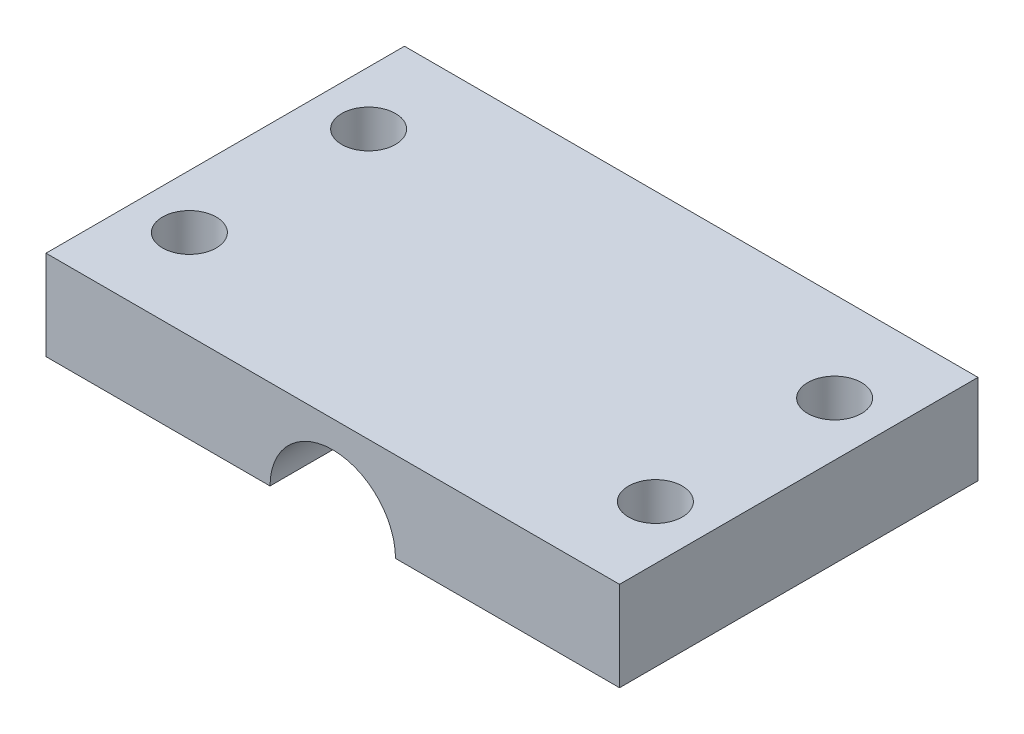
from build123d import *

# Parameters (mm, degrees)
BOSS_EXTRUDE1_DEPTH = 20
CUT_EXTRUDE1_REACH  = 36.478
SKETCH3_R           = 1.5


with BuildPart() as part:
    # Sketch1 → Boss-Extrude1 (new body)
    with BuildSketch(Plane.XY):
        with BuildLine():
            Line((8.135150199, -2.180546666), (-4.364849801, -2.180546666))
            Line((-4.364849801, -2.180546666), (-4.364849801, 2.819453334))
            Line((-4.364849801, 2.819453334), (27.635150199, 2.819453334))
            Line((27.635150199, 2.819453334), (27.635150199, -2.180546666))
            Line((27.635150199, -2.180546666), (15.135150199, -2.180546666))
            ThreePointArc((15.135150199, -2.180546666), (11.635150199, 1.319453334), (8.135150199, -2.180546666))
        make_face()
    extrude(amount=BOSS_EXTRUDE1_DEPTH)

    # Sketch3 → Cut-Extrude1 (cut, up to next)
    with BuildSketch(Plane.XZ.offset(2.180546666), mode=Mode.PRIVATE) as cut_extrude1_sk1:
        with Locations((-1.364849801, 15)):
            Circle(SKETCH3_R)
    cut_extrude1_tool1 = extrude(cut_extrude1_sk1.sketch, amount=-CUT_EXTRUDE1_REACH, mode=Mode.PRIVATE) & part.part
    # Sketch3 → Cut-Extrude1 (cut, up to next)
    with BuildSketch(Plane.XZ.offset(2.180546666), mode=Mode.PRIVATE) as cut_extrude1_sk2:
        with Locations((-1.364849801, 5)):
            Circle(SKETCH3_R)
    cut_extrude1_tool2 = extrude(cut_extrude1_sk2.sketch, amount=-CUT_EXTRUDE1_REACH, mode=Mode.PRIVATE) & part.part
    # Sketch3 → Cut-Extrude1 (cut, up to next)
    with BuildSketch(Plane.XZ.offset(2.180546666), mode=Mode.PRIVATE) as cut_extrude1_sk3:
        with Locations((24.635150199, 15)):
            Circle(SKETCH3_R)
    cut_extrude1_tool3 = extrude(cut_extrude1_sk3.sketch, amount=-CUT_EXTRUDE1_REACH, mode=Mode.PRIVATE) & part.part
    # Sketch3 → Cut-Extrude1 (cut, up to next)
    with BuildSketch(Plane.XZ.offset(2.180546666), mode=Mode.PRIVATE) as cut_extrude1_sk4:
        with Locations((24.635150199, 5)):
            Circle(SKETCH3_R)
    cut_extrude1_tool4 = extrude(cut_extrude1_sk4.sketch, amount=-CUT_EXTRUDE1_REACH, mode=Mode.PRIVATE) & part.part
    add(cut_extrude1_tool1.solids().sort_by_distance((-1.36485, -2.180547, 15))[0], mode=Mode.SUBTRACT)
    add(cut_extrude1_tool2.solids().sort_by_distance((-1.36485, -2.180547, 5))[0], mode=Mode.SUBTRACT)
    add(cut_extrude1_tool3.solids().sort_by_distance((24.63515, -2.180547, 15))[0], mode=Mode.SUBTRACT)
    add(cut_extrude1_tool4.solids().sort_by_distance((24.63515, -2.180547, 5))[0], mode=Mode.SUBTRACT)


solid = part.part
